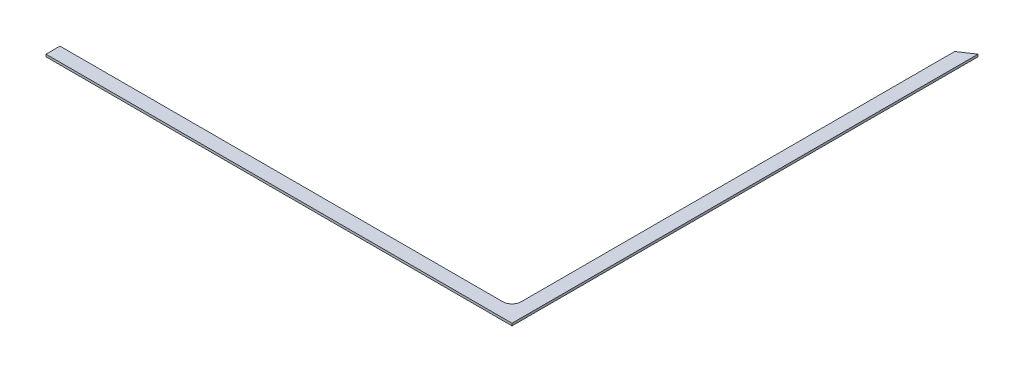
from build123d import *

# Parameters (mm, degrees)
BOSS_EXTRUDE2_DEPTH = 0.125
FILLET2_R           = 1


with BuildPart() as part:
    # Sketch2 → Boss-Extrude2 (new, symmetric)
    with BuildSketch(Plane(origin=(0, 0, 0), x_dir=(1, 0, 0), z_dir=(0, 1, 0))):
        Polygon((0, 0), (0, 47.5), (1.5, 48.5), (1.5, -1.5), (-48.5, -1.5), (-48.5, 0), align=None)
    extrude(amount=BOSS_EXTRUDE2_DEPTH, both=True)

    # Fillet2
    fillet2_edges = [part.edges().sort_by_distance(p)[0] for p in [
        (0, 0, 0),
    ]]
    fillet(fillet2_edges, radius=FILLET2_R)


solid = part.part
